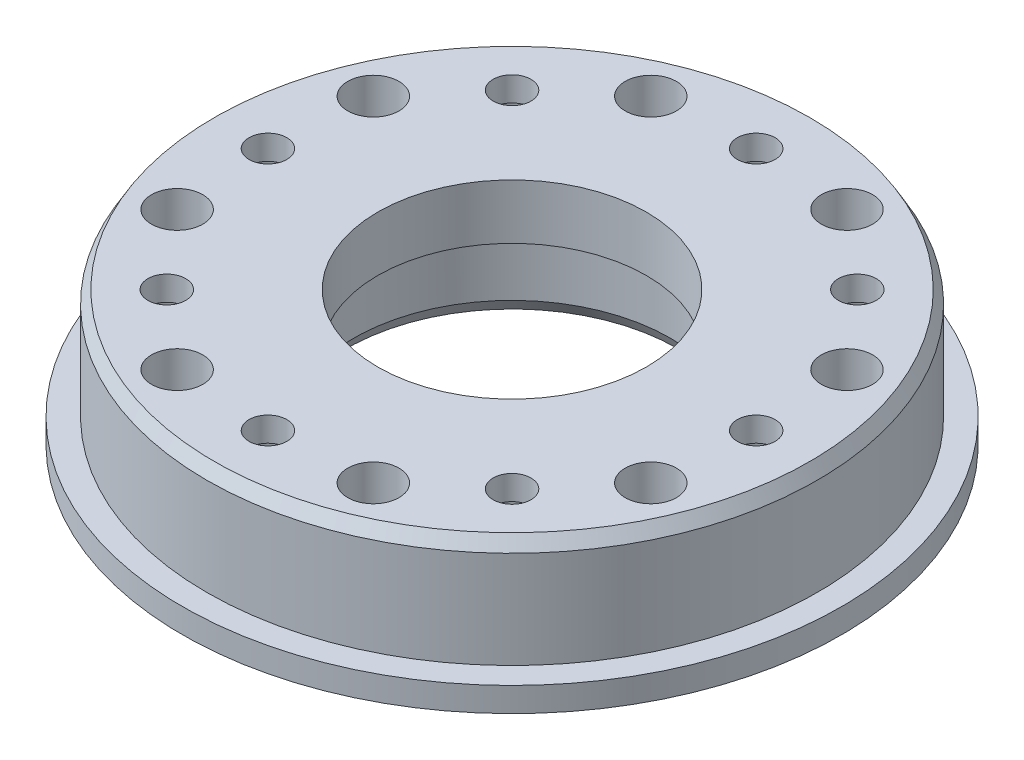
from build123d import *
from OCP.BRepFilletAPI import BRepFilletAPI_MakeChamfer

# Parameters (mm, degrees)
CIRPATTERN1_COUNT   = 8
SKETCH7_R           = 2.1
CUT_EXTRUDE3_DEPTH  = 40.736632973
CUT_EXTRUDE7_START  = -4
SKETCH7_3_R         = 2.1
CUT_EXTRUDE7_DEPTH  = 36.736632973
SKETCH8_R           = 0.3
BOSS_EXTRUDE3_DEPTH = 2.8
CIRPATTERN7_COUNT   = 8
SKETCH6_R           = 4
SKETCH6_R_2         = 2.625
BOSS_EXTRUDE2_DEPTH = 0.5
CIRPATTERN5_COUNT   = 8
CHAMFER1_SIZE       = 0.6
CHAMFER1_SIZE2      = 1.039230485


with BuildPart() as part:
    # Sketch1 → Revolve1 (revolve)
    with BuildSketch(Plane.XY, mode=Mode.PRIVATE) as revolve1_sk:
        Polygon((-11, 11), (-25, 11), (-25, 2), (-27, 2), (-27, 0), (-13, 0), (-13, 6.5), (-11, 6.5), align=None)
    revolve(revolve1_sk.sketch.rotate(Axis((0, 0, 0), (0, 1, 0)), 270), axis=Axis((0, 0, 0), (0, 1, 0)))

    # Sketch2 → Cut-Revolve1 (revolve, cut)
    with BuildSketch(Plane.XY):
        Polygon((-20, 11), (-20, 0), (-22.625, 0), (-22.625, 9), (-21.55, 9), (-21.55, 11), align=None)
    cut_revolve1 = revolve(axis=Axis((-20, 11, 0), (0, -1, 0)), mode=Mode.SUBTRACT)

    # CirPattern1: Cut-Revolve1 ×8 about axis
    cirpattern1_axis = Axis((0, 0, 0), (0, 1, 0))
    for i in range(1, CIRPATTERN1_COUNT):
        add(cut_revolve1.rotate(cirpattern1_axis, i * 360 / CIRPATTERN1_COUNT), mode=Mode.SUBTRACT)

    # Sketch7 → Cut-Extrude3 (cut, through all)
    with BuildSketch(Plane(origin=(0, 11, 0), x_dir=(1, 0, 0), z_dir=(0, 1, 0))):
        with Locations(Location((-19.401470183, 8.03635208, 0), (0, 0, 270))):
            Circle(SKETCH7_R)
    cut_extrude3 = extrude(amount=-CUT_EXTRUDE3_DEPTH, mode=Mode.SUBTRACT)

    # Sketch7<3> → Cut-Extrude7 (cut, through all)
    with BuildSketch(Plane(origin=(0, 11, 0), x_dir=(1, 0, 0), z_dir=(0, 1, 0)).offset(CUT_EXTRUDE7_START)):
        Polygon((-15.39459348, 8.563867405), (-17.854873504, 11.770166757), (-21.861750207, 11.242651432), (-23.408346886, 7.508836754), (-20.948066862, 4.302537402), (-16.941190158, 4.830052728), align=None)
        with Locations(Location((-19.401470183, 8.03635208, 0), (0, 0, 270))):
            Circle(SKETCH7_3_R, mode=Mode.SUBTRACT)
    cut_extrude7 = extrude(amount=-CUT_EXTRUDE7_DEPTH, mode=Mode.SUBTRACT)

    # Sketch8 → Boss-Extrude3 (add)
    with BuildSketch(Plane.XZ):
        with Locations((-20.948066862, -4.302537402)):
            Circle(SKETCH8_R)
        with Locations((-16.941190158, -4.830052728)):
            Circle(SKETCH8_R)
        with Locations((-15.39459348, -8.563867405)):
            Circle(SKETCH8_R)
        with Locations((-17.854873504, -11.770166757)):
            Circle(SKETCH8_R)
        with Locations((-21.861750207, -11.242651432)):
            Circle(SKETCH8_R)
        with Locations((-23.408346886, -7.508836754)):
            Circle(SKETCH8_R)
    boss_extrude3 = extrude(amount=-BOSS_EXTRUDE3_DEPTH)

    # CirPattern7: Cut-Extrude3, Cut-Extrude7, Boss-Extrude3 ×8 about axis
    cirpattern7_axis = Axis((0, 0, 0), (0, 1, 0))
    add([cut_extrude3.rotate(cirpattern7_axis, i * 360 / CIRPATTERN7_COUNT) for i in range(1, CIRPATTERN7_COUNT)], mode=Mode.SUBTRACT)
    add([cut_extrude7.rotate(cirpattern7_axis, i * 360 / CIRPATTERN7_COUNT) for i in range(1, CIRPATTERN7_COUNT)], mode=Mode.SUBTRACT)
    add([boss_extrude3.rotate(cirpattern7_axis, i * 360 / CIRPATTERN7_COUNT) for i in range(1, CIRPATTERN7_COUNT)])

    # Sketch6 → Boss-Extrude2 (add)
    with BuildSketch(Plane(origin=(0, 0, 0), x_dir=(-1, 0, 0), z_dir=(0, -1, 0))):
        with Locations(Location((20, 0, 0), (0, 0, 270))):
            Circle(SKETCH6_R)
        with Locations((20, 0)):
            Circle(SKETCH6_R_2, mode=Mode.SUBTRACT)
    boss_extrude2 = extrude(amount=BOSS_EXTRUDE2_DEPTH)

    # CirPattern5: Boss-Extrude2 ×8 about axis
    cirpattern5_axis = Axis((0, 0, 0), (0, 1, 0))
    for i in range(1, CIRPATTERN5_COUNT):
        add(boss_extrude2.rotate(cirpattern5_axis, i * 360 / CIRPATTERN5_COUNT))

    # Chamfer1: one chamfer whose edges measure the first distance from different faces: ONE call of the kernel's chamfer builder (chamfer() names one face for all edges)
    chamfer1_edges_1 = [part.edges().sort_by_distance(p)[0] for p in [
        (0, 0, 13),
    ]]
    chamfer1_side_1 = [part.faces().sort_by_distance(p)[0] for p in [
        (0, 0, 26.236324676),
    ]]
    chamfer1_edges_2 = [part.edges().sort_by_distance(p)[0] for p in [
        (0, 11, 25),
    ]]
    chamfer1_side_2 = [part.faces().sort_by_distance(p)[0] for p in [
        (0, 11, 24.292893219),
    ]]
    chamfer1 = BRepFilletAPI_MakeChamfer(part.part.solid().wrapped)
    for e in chamfer1_edges_1:
        chamfer1.Add(CHAMFER1_SIZE, CHAMFER1_SIZE2, e.wrapped, chamfer1_side_1[0].wrapped)  # the first distance lies on this face
    for e in chamfer1_edges_2:
        chamfer1.Add(CHAMFER1_SIZE, CHAMFER1_SIZE2, e.wrapped, chamfer1_side_2[0].wrapped)  # the first distance lies on this face
    add(Compound.cast(chamfer1.Shape()), mode=Mode.REPLACE)


solid = part.part
